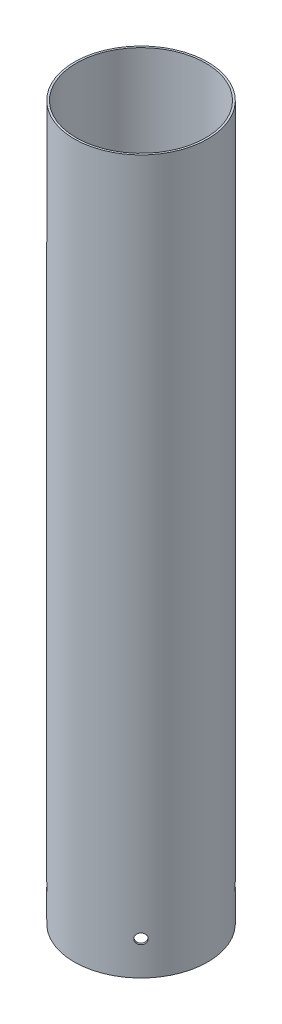
from build123d import *

# Parameters (mm, degrees)
SKETCH1_R               = 39.3
SKETCH1_R_2             = 38.15
BOSS_EXTRUDE1_DEPTH     = 420
CUT_EXTRUDE1_REACH      = 432.583
CUT_EXTRUDE1_END_RADIUS = 38.15
SKETCH2_R               = 3
CIRPATTERN1_COUNT       = 4


with BuildPart() as part:
    # Sketch1 → Boss-Extrude1 (new body)
    with BuildSketch(Plane(origin=(0, 0, 0), x_dir=(1, 0, 0), z_dir=(0, 1, 0))):
        with Locations(Location((0, 0, 0), (0, 0, 270))):
            Circle(SKETCH1_R)
        with Locations(Location((0, 0, 0), (0, 0, 270))):
            Circle(SKETCH1_R_2, mode=Mode.SUBTRACT)
    extrude(amount=BOSS_EXTRUDE1_DEPTH)

    # Cut-Extrude1: up to this cylinder (the profile starts outside it)
    cut_extrude1_end = Plane(origin=(0, 20, 0), z_dir=(0, -1, 0)) * Cylinder(CUT_EXTRUDE1_END_RADIUS, 942.466, mode=Mode.PRIVATE)
    # Sketch2 → Cut-Extrude1 (cut, up to the surface)
    with BuildSketch(Plane(origin=(-27.789296501, 0, 27.789296501), x_dir=(0, -1, 0), z_dir=(-0.7071067811865488, 0, 0.7071067811865464)), mode=Mode.PRIVATE) as cut_extrude1_sk1:
        with Locations(Location((-20, 0, 0), (0, 0, 90))):
            Circle(SKETCH2_R)
    cut_extrude1_tool1 = extrude(cut_extrude1_sk1.sketch, amount=-CUT_EXTRUDE1_REACH, mode=Mode.PRIVATE) - cut_extrude1_end
    cut_extrude1 = cut_extrude1_tool1.solids().sort_by_distance((-27.789297, 20, 27.789297))[0]
    add(cut_extrude1, mode=Mode.SUBTRACT)

    # CirPattern1: Cut-Extrude1 ×4 about axis
    cirpattern1_axis = Axis((0, 420, 0), (0, -1, 0))
    for i in range(1, CIRPATTERN1_COUNT):
        add(cut_extrude1.rotate(cirpattern1_axis, i * 360 / CIRPATTERN1_COUNT), mode=Mode.SUBTRACT)


solid = part.part
